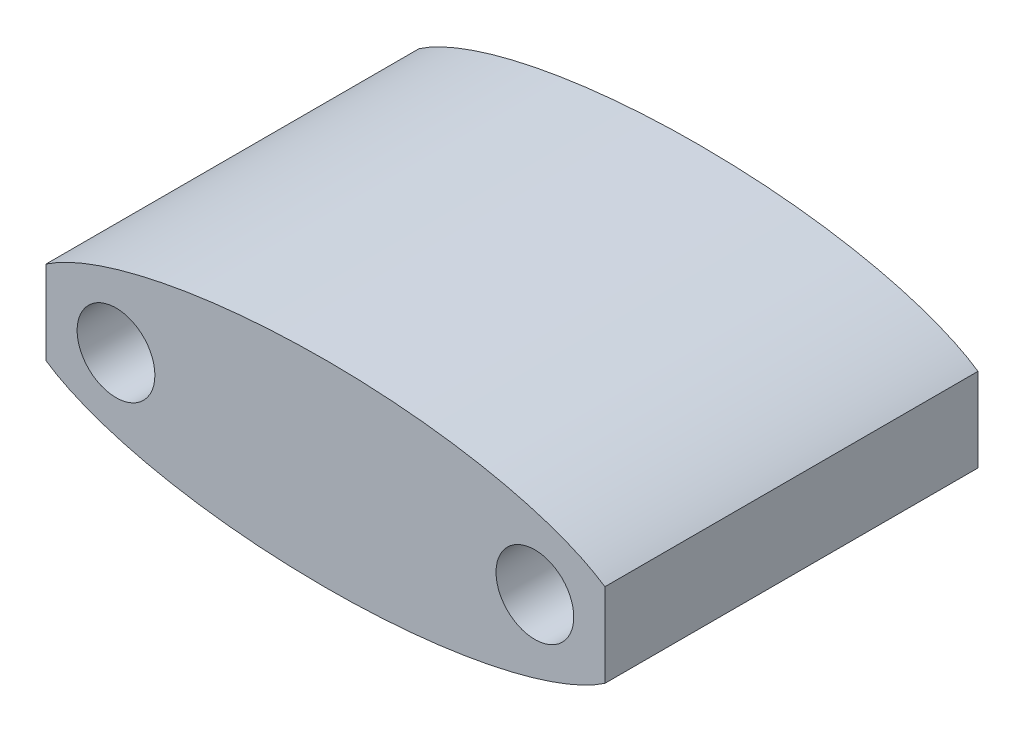
from build123d import *

# Parameters (mm, degrees)
BOSS_EXTRUDE1_DEPTH = 120
SKETCH2_R           = 12.5
CUT_EXTRUDE1_DEPTH  = 80


with BuildPart() as part:
    # Sketch1 → Boss-Extrude1 (new body)
    with BuildSketch(Plane.XY):
        with BuildLine():
            Line((-89.876617225, -13.45998777), (-89.876617225, 13.45998777))
            add(Edge.make_bspline(
                [(89.876617225, 13.45998777), (0, 74.633199683), (-89.876617225, 13.45998777)],
                knots=[3.580195105, 3.580195105, 3.580195105, 5.844582856, 5.844582856, 5.844582856], degree=2, weights=[1, 0.424674615, 1]))
            Line((89.876617225, 13.45998777), (89.876617225, -13.45998777))
            add(Edge.make_bspline(
                [(-89.876617225, -13.45998777), (0, -74.633199683), (89.876617225, -13.45998777)],
                knots=[0.438602452, 0.438602452, 0.438602452, 2.702990202, 2.702990202, 2.702990202], degree=2, weights=[1, 0.424674615, 1]))
        make_face()
    extrude(amount=BOSS_EXTRUDE1_DEPTH)

    # Sketch2 → Cut-Extrude1 (cut)
    with BuildSketch(Plane.XY.offset(120)):
        with Locations((-67.358364495, 0)):
            Circle(SKETCH2_R)
        with Locations(Location((67.358364495, 0, 0), (0, 0, 180))):
            Circle(SKETCH2_R)
    extrude(amount=-CUT_EXTRUDE1_DEPTH, mode=Mode.SUBTRACT)


solid = part.part
